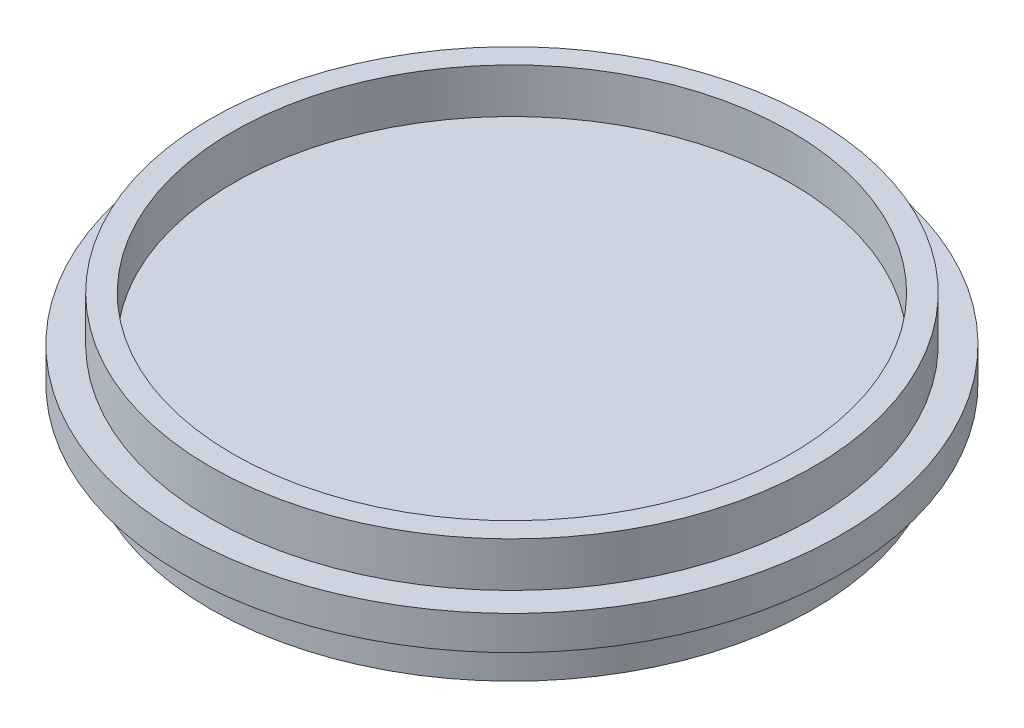
from build123d import *

# Parameters (mm, degrees)
SKETCH1_R           = 93.726
BOSS_EXTRUDE1_DEPTH = 4.826
SKETCH4_R           = 85.725
SKETCH4_R_2         = 79.375
BOSS_EXTRUDE2_DEPTH = 12.7


with BuildPart() as part:
    # Sketch1 → Boss-Extrude1 (new, symmetric)
    with BuildSketch(Plane(origin=(0, 0, 0), x_dir=(1, 0, 0), z_dir=(0, 1, 0))):
        with Locations(Location((0, 0, 0), (0, 0, 270))):
            Circle(SKETCH1_R)
    extrude(amount=BOSS_EXTRUDE1_DEPTH, both=True)

    # Sketch4 → Boss-Extrude2 (add)
    with BuildSketch(Plane(origin=(0, 4.826, 0), x_dir=(1, 0, 0), z_dir=(0, 1, 0))):
        with Locations(Location((0, 0, 0), (0, 0, 270))):
            Circle(SKETCH4_R)
        with Locations(Location((0, 0, 0), (0, 0, 270))):
            Circle(SKETCH4_R_2, mode=Mode.SUBTRACT)
    boss_extrude2 = extrude(amount=BOSS_EXTRUDE2_DEPTH)

    # Mirror2: Boss-Extrude2 across plane
    add(boss_extrude2.mirror(Plane.ZX))


solid = part.part
